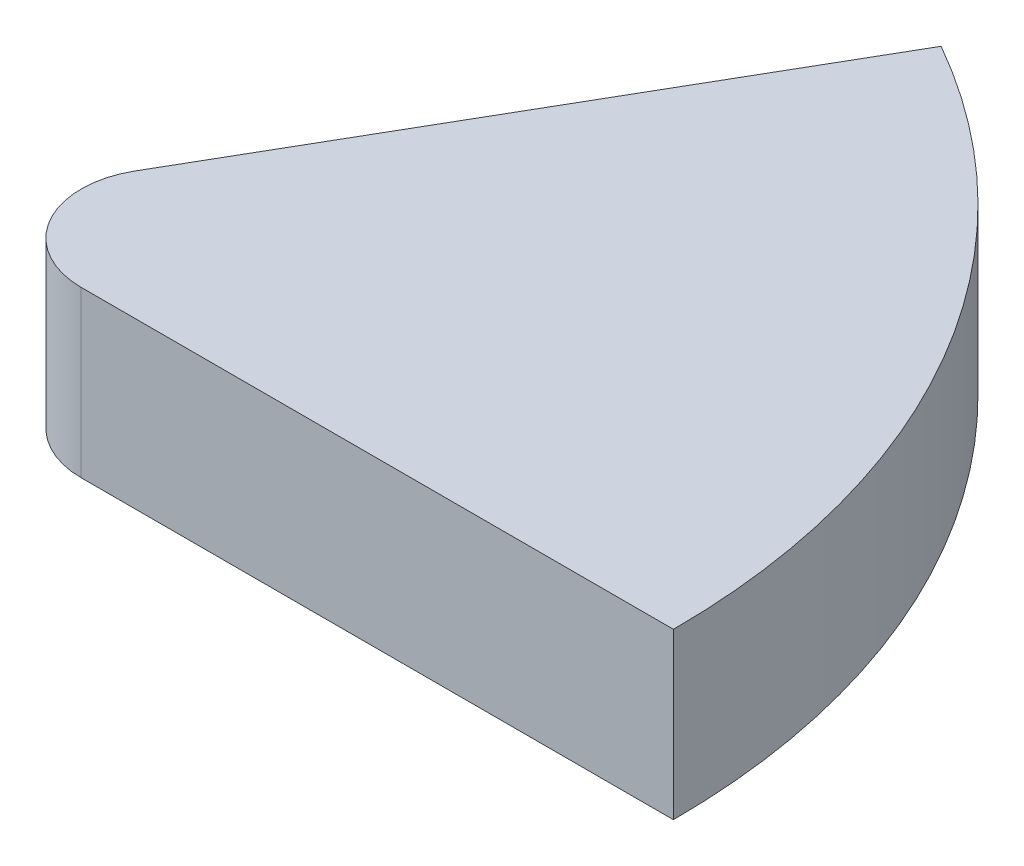
from build123d import *

# Parameters (mm, degrees)
BOSS_EXTRUDE1_DEPTH = 19.05


with BuildPart() as part:
    # Sketch1 → Boss-Extrude1 (new body)
    with BuildSketch(Plane(origin=(0, 0, 0), x_dir=(1, 0, 0), z_dir=(0, 1, 0))):
        with BuildLine():
            Line((-4.7625, 73.785690027), (-38.838832963, 14.76375))
            ThreePointArc((-38.838832963, 14.76375), (-38.838832963, 4.92125), (-30.314977926, 0))
            Line((-30.314977926, 0), (38.1, 0))
            ThreePointArc((38.1, 0), (26.606810407, 42.665917191), (-4.7625, 73.785690027))
        make_face()
    extrude(amount=BOSS_EXTRUDE1_DEPTH)


solid = part.part
